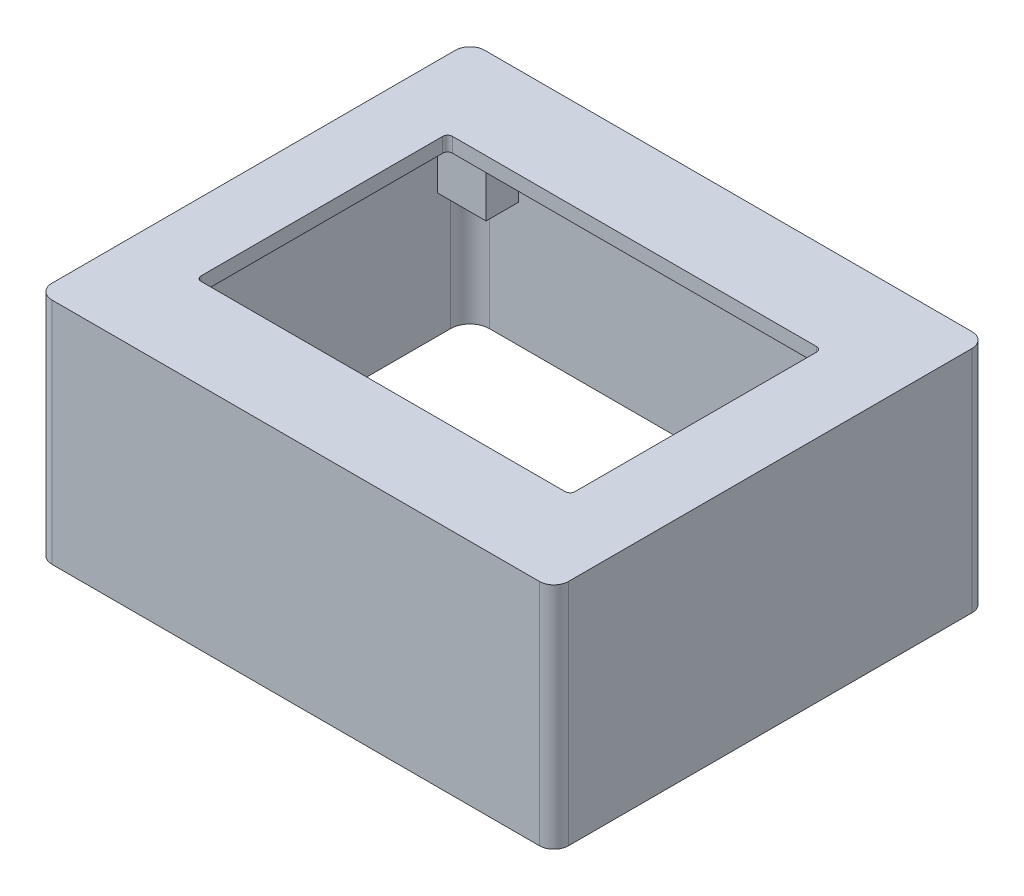
from build123d import *

# Parameters (mm, degrees)
SKETCH1_W           = 106.04
SKETCH1_H           = 88.81
SKETCH1_W_2         = 76.74
SKETCH1_H_2         = 51.6
BOSS_EXTRUDE1_DEPTH = 3
SKETCH1_3_W         = 10
SKETCH1_3_H         = 6.705
SKETCH1_3_R         = 1.35
BOSS_EXTRUDE2_DEPTH = 19.5
SKETCH1_4_W         = 106.04
SKETCH1_4_H         = 88.81
SKETCH1_4_W_2       = 102.04
SKETCH1_4_H_2       = 84.81
BOSS_EXTRUDE3_DEPTH = 47
FILLET1_R           = 4
FILLET2_R           = 3
FILLET3_R           = 1
CUT_EXTRUDE2_REACH  = 115.61
SKETCH3_W           = 14
SKETCH3_H           = 8


with BuildPart() as part:
    # Sketch1 → Boss-Extrude1 (new body)
    with BuildSketch(Plane(origin=(0, 0, 0), x_dir=(1, 0, 0), z_dir=(0, 1, 0))):
        Rectangle(SKETCH1_W, SKETCH1_H)
        with Locations((-0.65, 0)):
            Rectangle(SKETCH1_W_2, SKETCH1_H_2, mode=Mode.SUBTRACT)
    extrude(amount=-BOSS_EXTRUDE1_DEPTH)

    # Sketch1<3> → Boss-Extrude2 (add)
    # profile 1 of 4: a face of its own
    with BuildSketch(Plane(origin=(0, 0, 0), x_dir=(1, 0, 0), z_dir=(0, 1, 0))):
        with Locations((44.02, 37.0525)):
            Rectangle(SKETCH1_3_W, SKETCH1_3_H)
        with Locations((43.465, 36.8)):
            Circle(SKETCH1_3_R, mode=Mode.SUBTRACT)
    # profile 2 of 4: a face of its own
    with BuildSketch(Plane(origin=(0, 0, 0), x_dir=(1, 0, 0), z_dir=(0, 1, 0))):
        with Locations((-44.02, 37.0525)):
            Rectangle(SKETCH1_3_W, SKETCH1_3_H)
        with Locations((-43.465, 36.8)):
            Circle(SKETCH1_3_R, mode=Mode.SUBTRACT)
    # profile 3 of 4: a face of its own
    with BuildSketch(Plane(origin=(0, 0, 0), x_dir=(1, 0, 0), z_dir=(0, 1, 0))):
        with Locations((44.02, -37.0525)):
            Rectangle(SKETCH1_3_W, SKETCH1_3_H)
        with Locations((43.465, -36.8)):
            Circle(SKETCH1_3_R, mode=Mode.SUBTRACT)
    # profile 4 of 4: a face of its own
    with BuildSketch(Plane(origin=(0, 0, 0), x_dir=(1, 0, 0), z_dir=(0, 1, 0))):
        with Locations((-44.02, -37.0525)):
            Rectangle(SKETCH1_3_W, SKETCH1_3_H)
        with Locations((-43.465, -36.8)):
            Circle(SKETCH1_3_R, mode=Mode.SUBTRACT)
    extrude(amount=-BOSS_EXTRUDE2_DEPTH)

    # Sketch1<4> → Boss-Extrude3 (add)
    with BuildSketch(Plane(origin=(0, 0, 0), x_dir=(1, 0, 0), z_dir=(0, 1, 0))):
        Rectangle(SKETCH1_4_W, SKETCH1_4_H)
        Rectangle(SKETCH1_4_W_2, SKETCH1_4_H_2, mode=Mode.SUBTRACT)
    extrude(amount=-BOSS_EXTRUDE3_DEPTH)

    # Fillet1
    fillet1_edges = [part.edges().sort_by_distance(p)[0] for p in [
        (51.02, -25, -42.405),
        (-51.02, -25, -42.405),
        (51.02, -25, 42.405),
        (-51.02, -25, 42.405),
    ]]
    fillet(fillet1_edges, radius=FILLET1_R)

    # Fillet2
    fillet2_edges = [part.edges().sort_by_distance(p)[0] for p in [
        (-53.02, -23.5, 44.405),
        (53.02, -23.5, 44.405),
        (53.02, -23.5, -44.405),
        (-53.02, -23.5, -44.405),
    ]]
    fillet(fillet2_edges, radius=FILLET2_R)

    # Fillet3
    fillet3_edges = [part.edges().sort_by_distance(p)[0] for p in [
        (-39.02, -1.5, 25.8),
        (37.72, -1.5, 25.8),
        (37.72, -1.5, -25.8),
        (-39.02, -1.5, -25.8),
    ]]
    fillet(fillet3_edges, radius=FILLET3_R)

    # Sketch3 → Cut-Extrude2 (cut, up to next)
    with BuildSketch(Plane(origin=(0, 0, -44.405), x_dir=(-1, 0, 0), z_dir=(0, 0, -1)), mode=Mode.PRIVATE) as cut_extrude2_sk1:
        with Locations((-19.52, -34.5)):
            Rectangle(SKETCH3_W, SKETCH3_H)
    cut_extrude2_tool1 = extrude(cut_extrude2_sk1.sketch, amount=-CUT_EXTRUDE2_REACH, mode=Mode.PRIVATE) & part.part
    add(cut_extrude2_tool1.solids().sort_by_distance((19.52, -34.5, -44.405))[0], mode=Mode.SUBTRACT)


solid = part.part
